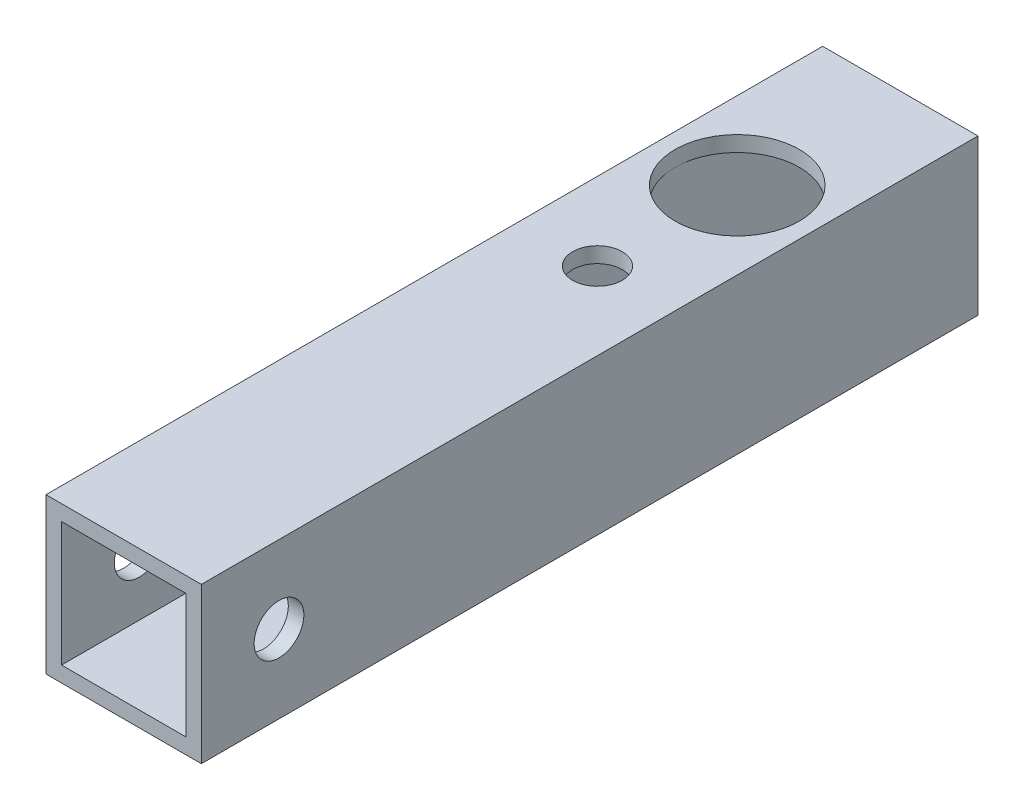
from build123d import *

# Parameters (mm, degrees)
SKETCH_1_W          = 10
SKETCH_1_H          = 10
SKETCH_1_W_2        = 8
SKETCH_1_H_2        = 8
EXTRUDE_1_DEPTH     = 50
SKETCH_2_R          = 4
SKETCH_2_R_2        = 1.6
CUT_EXTRUDE_1_DEPTH = 52.961524227
CUT_EXTRUDE_2_REACH = 53.962
SKETCH_4_R          = 2.6
SKETCH_5_R          = 1.6
CUT_EXTRUDE_3_DEPTH = 52.961524227


with BuildPart() as part:
    # ｽｹｯﾁ1 → 押し出し-薄板1 (new body)
    with BuildSketch(Plane.XY):
        with Locations((5, 5)):
            Rectangle(SKETCH_1_W, SKETCH_1_H)
        with Locations((5, 5)):
            Rectangle(SKETCH_1_W_2, SKETCH_1_H_2, mode=Mode.SUBTRACT)
    extrude(amount=EXTRUDE_1_DEPTH)

    # ｽｹｯﾁ2 → ｶｯﾄ - 押し出し1 (cut, through all)
    with BuildSketch(Plane(origin=(0, 10, 0), x_dir=(1, 0, 0), z_dir=(0, 1, 0))):
        with Locations(Location((5, -10.5, 0), (0, 0, 270))):
            Circle(SKETCH_2_R)
        with Locations(Location((5, -19.5, 0), (0, 0, 270))):
            Circle(SKETCH_2_R_2)
    extrude(amount=-CUT_EXTRUDE_1_DEPTH, mode=Mode.SUBTRACT)

    # ｽｹｯﾁ4 → ｶｯﾄ - 押し出し2 (cut, up to next)
    with BuildSketch(Plane.XZ, mode=Mode.PRIVATE) as cut_extrude_2_sk1:
        with Locations(Location((5, 19.5, 0), (0, 0, 270))):
            Circle(SKETCH_4_R)
    cut_extrude_2_tool1 = extrude(cut_extrude_2_sk1.sketch, amount=-CUT_EXTRUDE_2_REACH, mode=Mode.PRIVATE) & part.part
    add(cut_extrude_2_tool1.solids().sort_by_distance((5, 0, 19.5))[0], mode=Mode.SUBTRACT)

    # ｽｹｯﾁ5 → ｶｯﾄ - 押し出し3 (cut, through all)
    with BuildSketch(Plane(origin=(10, 0, 0), x_dir=(0, 0, -1), z_dir=(1, 0, 0))):
        with Locations(Location((-45, 5, 0), (0, 0, 90))):
            Circle(SKETCH_5_R)
    extrude(amount=-CUT_EXTRUDE_3_DEPTH, mode=Mode.SUBTRACT)


solid = part.part
